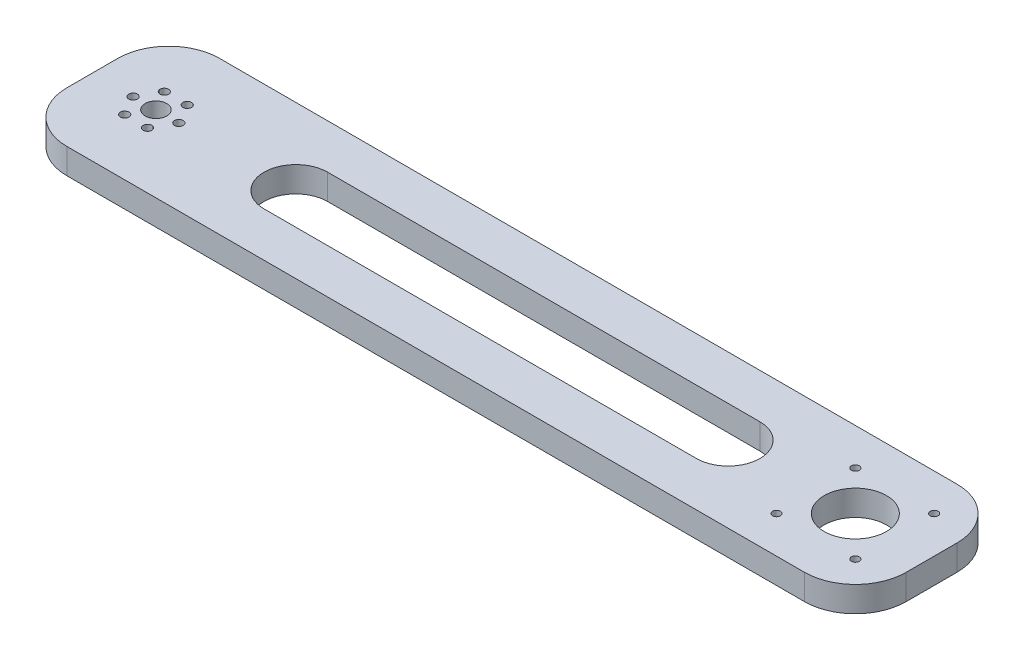
from build123d import *

# Parameters (mm, degrees)
SKETCH_1_W               = 330
SKETCH_1_H               = 60
EXTRUDE_1_DEPTH          = 10
FILLET_1_R               = 20
SKETCH_5_R               = 12.25
CUT_EXTRUDE_3_DEPTH      = 12
SKETCH_9_R               = 1.55
CUT_EXTRUDE_6_DEPTH      = 169.002976164
SKETCH_11_R              = 4.25
CUT_EXTRUDE_8_DEPTH      = 169.002976164
CUT_EXTRUDE_11_DEPTH     = 169.002976164
SKETCH_16_R              = 1.7
CUT_EXTRUDE_12_DEPTH     = 169.002976164
PATTERN_CIRCULAR_1_COUNT = 6


with BuildPart() as part:
    # 草图1 → 凸台-拉伸1 (new body)
    with BuildSketch(Plane(origin=(0, 0, 0), x_dir=(1, 0, 0), z_dir=(0, 1, 0))):
        Rectangle(SKETCH_1_W, SKETCH_1_H)
    extrude(amount=EXTRUDE_1_DEPTH)

    # 圆角1
    fillet_1_edges = [part.edges().sort_by_distance(p)[0] for p in [
        (165, 5, 30),
        (-165, 5, 30),
        (-165, 5, -30),
        (165, 5, -30),
    ]]
    fillet(fillet_1_edges, radius=FILLET_1_R)

    # 草图5 → 切除-拉伸3 (cut)
    with BuildSketch(Plane(origin=(0, 10, 0), x_dir=(1, 0, 0), z_dir=(0, 1, 0))):
        with Locations(Location((135, 0, 0), (0, 0, 270))):
            Circle(SKETCH_5_R)
    extrude(amount=-CUT_EXTRUDE_3_DEPTH, mode=Mode.SUBTRACT)

    # 草图9 → 切除-拉伸6 (cut, through all)
    with BuildSketch(Plane.XZ):
        with Locations(Location((119.5, 15.5, 0), (0, 0, 270))):
            Circle(SKETCH_9_R)
        with Locations(Location((150.5, 15.5, 0), (0, 0, 270))):
            Circle(SKETCH_9_R)
        with Locations(Location((150.5, -15.5, 0), (0, 0, 270))):
            Circle(SKETCH_9_R)
        with Locations(Location((119.5, -15.5, 0), (0, 0, 270))):
            Circle(SKETCH_9_R)
    extrude(amount=-CUT_EXTRUDE_6_DEPTH, mode=Mode.SUBTRACT)

    # 草图11 → 切除-拉伸8 (cut, through all)
    with BuildSketch(Plane.XZ):
        with Locations(Location((-140, 0, 0), (0, 0, 270))):
            Circle(SKETCH_11_R)
    extrude(amount=-CUT_EXTRUDE_8_DEPTH, mode=Mode.SUBTRACT)

    # 草图15 → 切除-拉伸11 (cut, through all)
    with BuildSketch(Plane.XZ):
        with BuildLine():
            Line((-85, 12.5), (85, 12.5))
            ThreePointArc((85, 12.5), (97.5, 0), (85, -12.5))
            Line((85, -12.5), (-85, -12.5))
            ThreePointArc((-85, -12.5), (-97.5, 0), (-85, 12.5))
        make_face()
    extrude(amount=-CUT_EXTRUDE_11_DEPTH, mode=Mode.SUBTRACT)

    # 草图16 → 切除-拉伸12 (cut, through all)
    with BuildSketch(Plane.XZ):
        with Locations(Location((-149, 0, 0), (0, 0, 270))):
            Circle(SKETCH_16_R)
    cut_extrude_12 = extrude(amount=-CUT_EXTRUDE_12_DEPTH, mode=Mode.SUBTRACT)

    # 阵列(圆周)1: 切除-拉伸12 ×6 about axis
    pattern_circular_1_axis = Axis((-140, 0, 0), (0, 1, 0))
    for i in range(1, PATTERN_CIRCULAR_1_COUNT):
        add(cut_extrude_12.rotate(pattern_circular_1_axis, i * 360 / PATTERN_CIRCULAR_1_COUNT), mode=Mode.SUBTRACT)


solid = part.part
